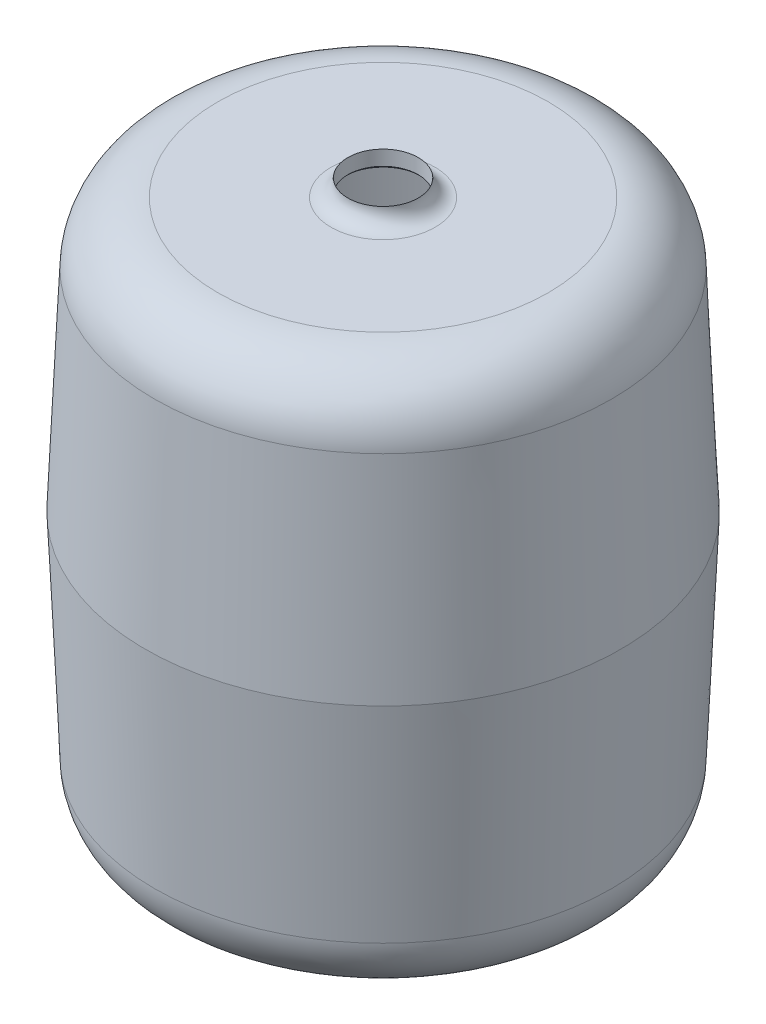
from build123d import *

# Parameters (mm, degrees)
SKETCH3_R          = 25
CUT_EXTRUDE4_DEPTH = 405.5


with BuildPart() as part:
    # Sketch2 → Revolve1 (revolve)
    with BuildSketch(Plane.XY):
        with BuildLine():
            Line((0, 0), (6.580266119, 150.712872431))
            ThreePointArc((6.580266119, 150.712872431), (20.41934858, 181.256378293), (51.53743609, 193.75))
            Line((51.53743609, 193.75), (132.080266119, 193.75))
            ThreePointArc((132.080266119, 193.75), (140.565547493, 197.264718626), (144.080266119, 205.75))
            Line((144.080266119, 205.75), (144.080266119, 213.75))
            Line((144.080266119, 213.75), (169.080266119, 213.75))
            Line((169.080266119, 213.75), (169.080266119, -193.75))
            Line((169.080266119, -193.75), (51.53743609, -193.75))
            ThreePointArc((51.53743609, -193.75), (20.41934858, -181.256378293), (6.580266119, -150.712872431))
            Line((6.580266119, -150.712872431), (0, 0))
        make_face()
        with BuildLine():
            Line((165.080266119, 209.75), (165.080266119, -189.75))
            Line((165.080266119, -189.75), (51.53743609, -189.75))
            ThreePointArc((51.53743609, -189.75), (23.185400803, -178.366922444), (10.576459005, -150.538394882))
            Line((10.576459005, -150.538394882), (4.003810741, 0))
            Line((4.003810741, 0), (10.576459005, 150.538394882))
            ThreePointArc((10.576459005, 150.538394882), (23.185400803, 178.366922444), (51.53743609, 189.75))
            Line((51.53743609, 189.75), (132.080266119, 189.75))
            ThreePointArc((132.080266119, 189.75), (143.393974618, 194.436291501), (148.080266119, 205.75))
            Line((148.080266119, 205.75), (148.080266119, 209.75))
            Line((148.080266119, 209.75), (165.080266119, 209.75))
        make_face(mode=Mode.SUBTRACT)
    revolve(axis=Axis((169.080266119, 213.75, 0), (0, -1, 0)))

    # Sketch3 → Cut-Extrude4 (cut)
    with BuildSketch(Plane(origin=(0, 213.75, 0), x_dir=(1, 0, 0), z_dir=(0, 1, 0))):
        with Locations(Location((169.080266119, 0, 0), (0, 0, 180))):
            Circle(SKETCH3_R)
    extrude(amount=-CUT_EXTRUDE4_DEPTH, mode=Mode.SUBTRACT)


solid = part.part
